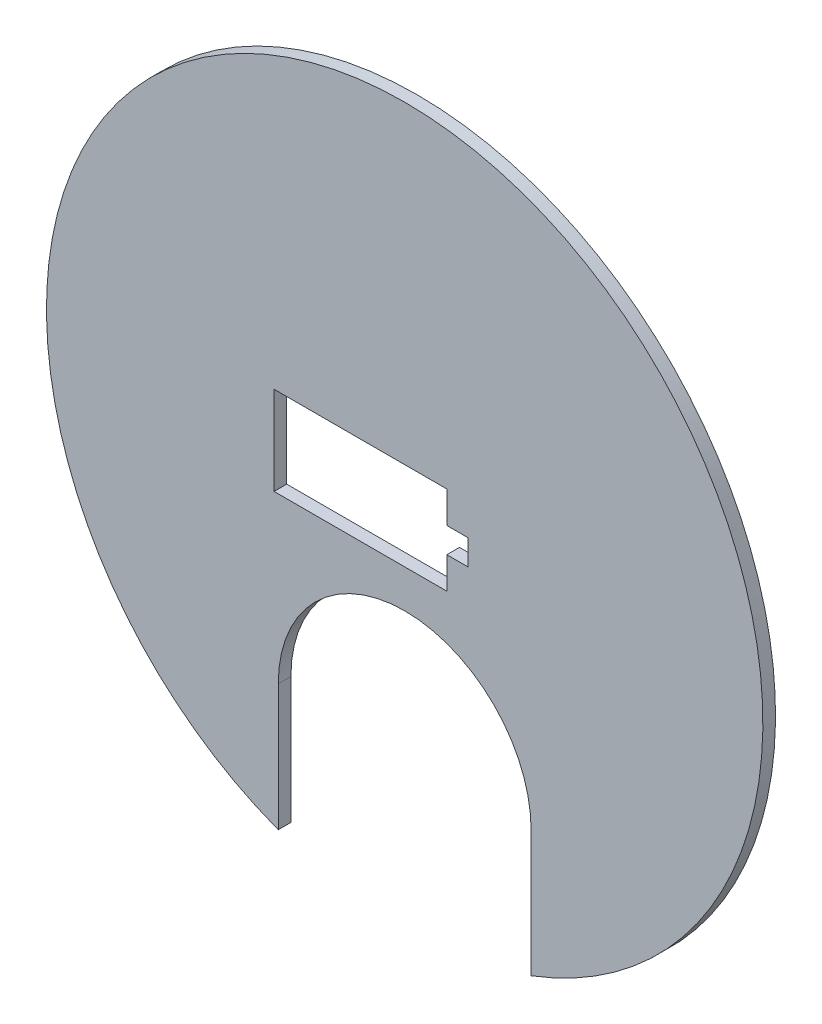
from build123d import *

# Parameters (mm, degrees)
ESQUISSE1_R              = 85
BOSS_EXTRU_1_DEPTH       = 3
ESQUISSE2_R              = 1
ENL_V_MAT_EXTRU_1_DEPTH  = 3
ENL_V_MAT_EXTRU_10_DEPTH = 3


with BuildPart() as part:
    # Esquisse1 → Boss.-Extru.1 (new body)
    with BuildSketch(Plane.XY):
        with Locations((-11.197924537, 8.24446622)):
            Circle(ESQUISSE1_R)
    extrude(amount=BOSS_EXTRU_1_DEPTH)

    # Esquisse2 → Enlèv. mat.-Extru.1 (cut)
    # profile 1 of 2: a face of its own
    with BuildSketch(Plane(origin=(0, 0, 0), x_dir=(-1, 0, 0), z_dir=(0, 0, -1))):
        Polygon((-3.802075463, 11.24446622), (-3.802075463, 5.24446622), (1.197924537, 5.24446622), (1.197924537, -2.25553378), (42.197924537, -2.25553378), (42.197924537, 18.74446622), (1.197924537, 18.74446622), (1.197924537, 11.24446622), align=None)
        with Locations((11.197924537, 8.24446622)):
            Circle(ESQUISSE2_R, mode=Mode.SUBTRACT)
    # profile 2 of 2: a face of its own
    with BuildSketch(Plane(origin=(0, 0, 0), x_dir=(-1, 0, 0), z_dir=(0, 0, -1))):
        with Locations((11.197924537, 8.24446622)):
            Circle(ESQUISSE2_R)
    extrude(amount=-ENL_V_MAT_EXTRU_1_DEPTH, mode=Mode.SUBTRACT)

    # Esquisse3 → Enlèv. mat.-Extru.10 (cut)
    with BuildSketch(Plane(origin=(0, 0, 0), x_dir=(-1, 0, 0), z_dir=(0, 0, -1))):
        with BuildLine():
            Line((-18.802075463, -71.285402383), (-18.802075463, -41.285402383))
            ThreePointArc((-18.802075463, -41.285402383), (11.197924537, -11.285402383), (41.197924537, -41.285402383))
            Line((41.197924537, -41.285402383), (41.197924537, -71.285402383))
            ThreePointArc((41.197924537, -71.285402383), (11.197924537, -76.75553378), (-18.802075463, -71.285402383))
        make_face()
    extrude(amount=-ENL_V_MAT_EXTRU_10_DEPTH, mode=Mode.SUBTRACT)


solid = part.part
